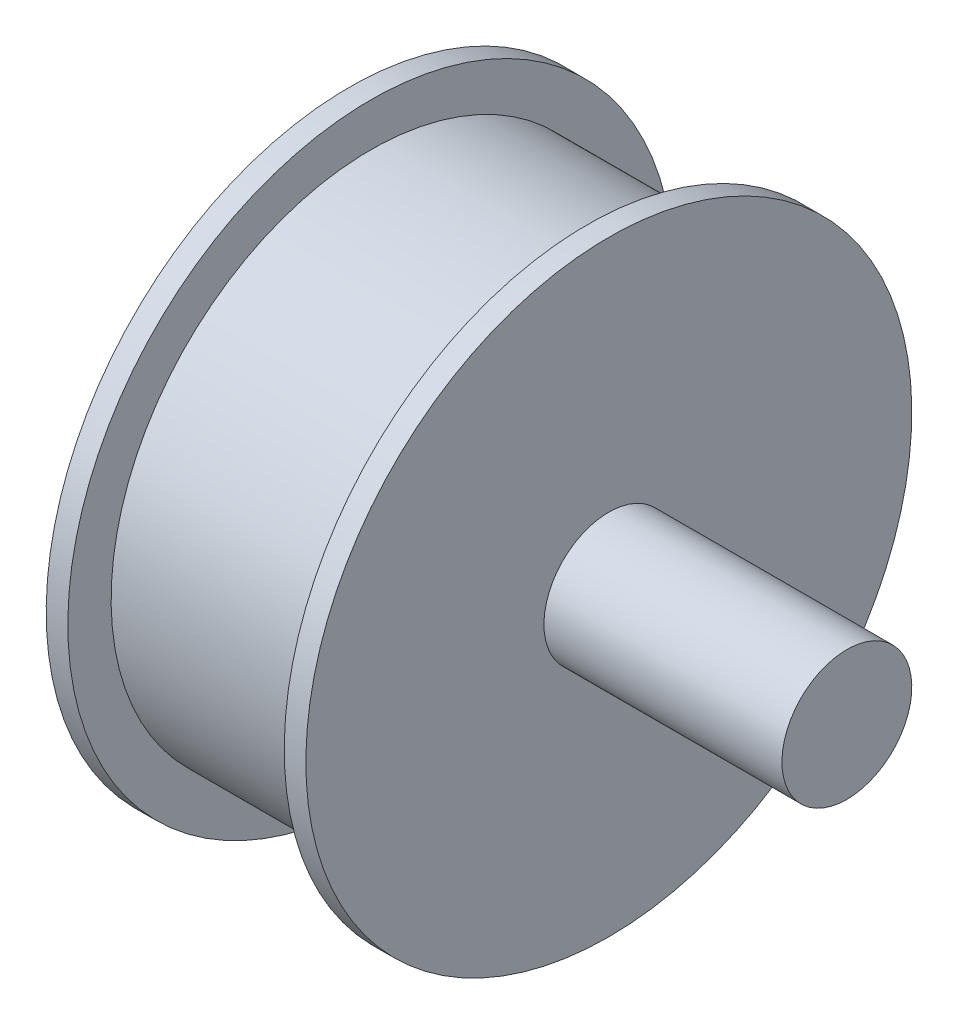
from build123d import *

# Parameters (mm, degrees)
FILLET1_R = 1


with BuildPart() as part:
    # Sketch1 → Revolve1 (revolve)
    with BuildSketch(Plane.XY, mode=Mode.PRIVATE) as revolve1_sk:
        Polygon((0, 7.5), (0, 35), (-2.5, 35), (-2.5, 30), (-27.5, 30), (-27.5, 35), (-30, 35), (-30, 25), (-25, 25), (-25, 10), (-30, 10), (-30, 5), (-27.5, 5), (-27.5, 0), (27.5, 0), (27.5, 7.5), align=None)
    revolve(revolve1_sk.sketch.rotate(Axis((-27.5, 0, 0), (1, 0, 0)), 180), axis=Axis((-27.5, 0, 0), (1, 0, 0)))

    # Fillet1
    fillet1_edges = [part.edges().sort_by_distance(p)[0] for p in [
        (-30, 10, 0),
    ]]
    fillet(fillet1_edges, radius=FILLET1_R)


solid = part.part
